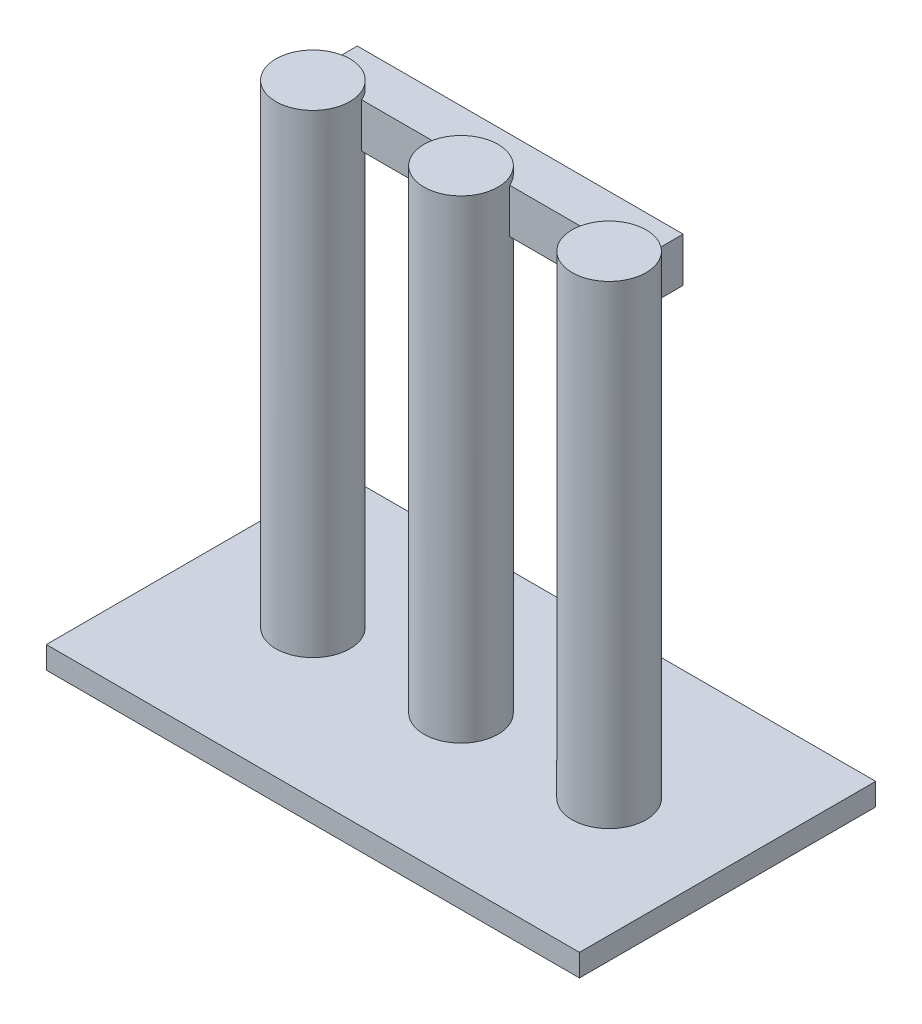
from build123d import *

# Parameters (mm, degrees)
SKETCH1_W           = 3600
SKETCH1_H           = 2000
BOSS_EXTRUDE1_DEPTH = 150
BOSS_EXTRUDE2_START = 150
SKETCH2_R           = 250
BOSS_EXTRUDE2_DEPTH = 3200
BOSS_EXTRUDE3_START = 150
SKETCH3_R           = 250
BOSS_EXTRUDE3_DEPTH = 3200
BOSS_EXTRUDE4_START = 150
SKETCH4_R           = 250
BOSS_EXTRUDE4_DEPTH = 3200
BOSS_EXTRUDE5_START = 3000
SKETCH5_W           = 2200
SKETCH5_H           = 300
BOSS_EXTRUDE5_DEPTH = 300


with BuildPart() as part:
    # Sketch1 → Boss-Extrude1 (new body)
    with BuildSketch(Plane(origin=(0, 0, 0), x_dir=(1, 0, 0), z_dir=(0, 1, 0))):
        with Locations((-5500, 4000)):
            Rectangle(SKETCH1_W, SKETCH1_H)
    extrude(amount=BOSS_EXTRUDE1_DEPTH)

    # Sketch2 → Boss-Extrude2 (add)
    with BuildSketch(Plane(origin=(0, 0, 0), x_dir=(1, 0, 0), z_dir=(0, 1, 0)).offset(BOSS_EXTRUDE2_START)):
        with Locations(Location((-6500, 4000, 0), (0, 0, 90))):
            Circle(SKETCH2_R)
    extrude(amount=BOSS_EXTRUDE2_DEPTH)

    # Sketch3 → Boss-Extrude3 (add)
    with BuildSketch(Plane(origin=(0, 0, 0), x_dir=(1, 0, 0), z_dir=(0, 1, 0)).offset(BOSS_EXTRUDE3_START)):
        with Locations(Location((-5500, 4000, 0), (0, 0, 90))):
            Circle(SKETCH3_R)
    extrude(amount=BOSS_EXTRUDE3_DEPTH)

    # Sketch4 → Boss-Extrude4 (add)
    with BuildSketch(Plane(origin=(0, 0, 0), x_dir=(1, 0, 0), z_dir=(0, 1, 0)).offset(BOSS_EXTRUDE4_START)):
        with Locations(Location((-4500, 4000, 0), (0, 0, 90))):
            Circle(SKETCH4_R)
    extrude(amount=BOSS_EXTRUDE4_DEPTH)

    # Sketch5 → Boss-Extrude5 (add)
    with BuildSketch(Plane(origin=(0, 0, 0), x_dir=(1, 0, 0), z_dir=(0, 1, 0)).offset(BOSS_EXTRUDE5_START)):
        with Locations((-5500, 4250)):
            Rectangle(SKETCH5_W, SKETCH5_H)
    extrude(amount=BOSS_EXTRUDE5_DEPTH)


solid = part.part
